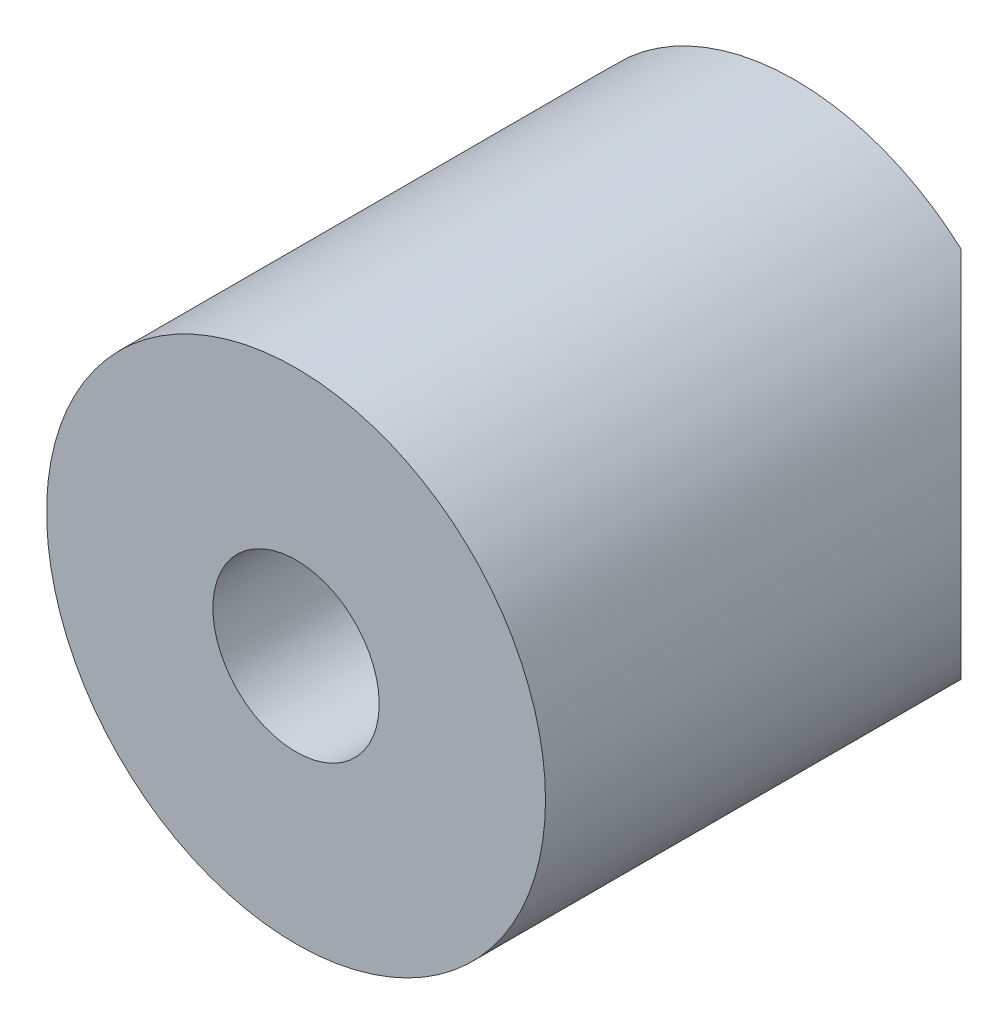
from build123d import *

# Parameters (mm, degrees)
SKETCH1_R               = 38.1
SKETCH1_R_2             = 12.7
BOSS_EXTRUDE1_DEPTH     = 76.2
CUT_EXTRUDE1_DEPTH      = 94.3255592
CUT_EXTRUDE1_DEPTH_BACK = 94.3255592


with BuildPart() as part:
    # Sketch1 → Boss-Extrude1 (new body)
    with BuildSketch(Plane.XY):
        Circle(SKETCH1_R)
        Circle(SKETCH1_R_2, mode=Mode.SUBTRACT)
    extrude(amount=-BOSS_EXTRUDE1_DEPTH)

    # Sketch2 → Cut-Extrude1 (cut, two sides: drawn at the far end of the back side and taken through both)
    with BuildSketch(Plane(origin=(0, 0, 0), x_dir=(1, 0, 0), z_dir=(0, 1, 0)).offset(-CUT_EXTRUDE1_DEPTH_BACK)):
        Polygon((-25.4, 76.2), (-38.1, 63.5), (-38.1, 76.2), align=None)
        Polygon((38.1, 76.2), (25.4, 76.2), (38.1, 63.5), align=None)
    extrude(amount=CUT_EXTRUDE1_DEPTH + CUT_EXTRUDE1_DEPTH_BACK, mode=Mode.SUBTRACT)


solid = part.part
